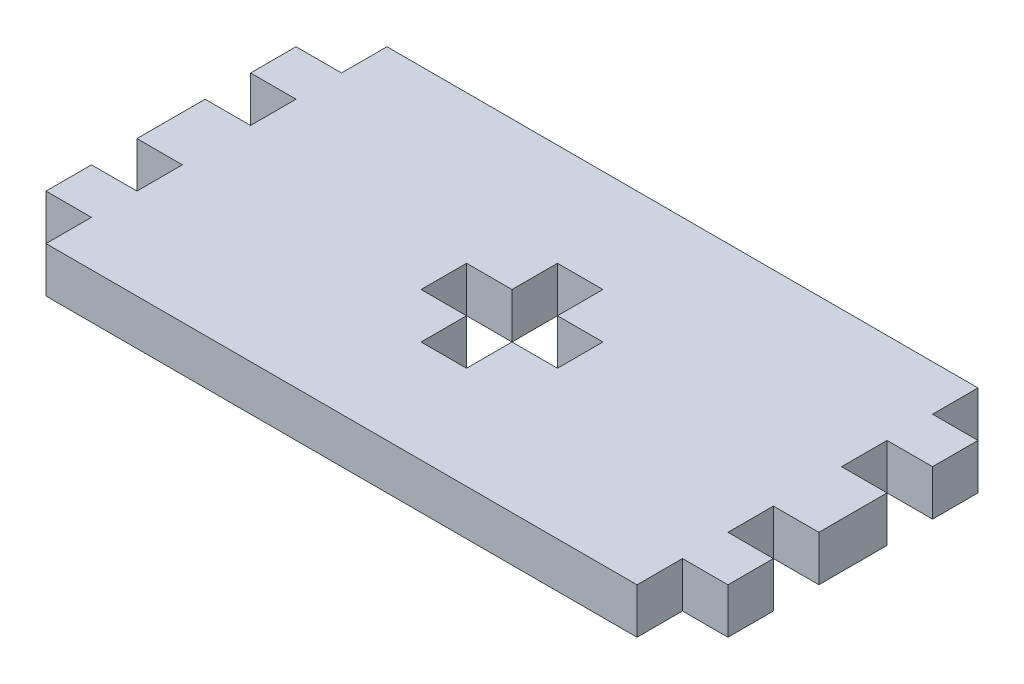
from build123d import *

# Parameters (mm, degrees)
SKETCH1_W           = 76.2
SKETCH1_H           = 38.1
BOSS_EXTRUDE1_DEPTH = 5.08
SKETCH2_W           = 5.08
SKETCH2_H           = 5.08
CUT_EXTRUDE1_DEPTH  = 5.08


with BuildPart() as part:
    # Sketch1 → Boss-Extrude1 (new body)
    with BuildSketch(Plane(origin=(0, 0, 0), x_dir=(1, 0, 0), z_dir=(0, 1, 0))):
        with Locations((-0.653142857, 12.627428571)):
            Rectangle(SKETCH1_W, SKETCH1_H)
    extrude(amount=BOSS_EXTRUDE1_DEPTH)

    # Sketch2 → Cut-Extrude1 (cut)
    with BuildSketch(Plane(origin=(0, 5.08, 0), x_dir=(1, 0, 0), z_dir=(0, 1, 0))):
        Polygon((1.886857143, 20.247428571), (-3.193142857, 20.247428571), (-3.193142857, 15.167428571), (-8.273142857, 15.167428571), (-8.273142857, 10.087428571), (-3.193142857, 10.087428571), (-3.193142857, 5.007428571), (1.886857143, 5.007428571), (1.886857143, 10.087428571), (6.966857143, 10.087428571), (6.966857143, 15.167428571), (1.886857143, 15.167428571), align=None)
        with Locations((-36.213142857, 18.977428571)):
            Rectangle(SKETCH2_W, SKETCH2_H)
        with Locations((-36.213142857, 29.137428571)):
            Rectangle(SKETCH2_W, SKETCH2_H)
        with Locations((-36.213142857, -3.882571429)):
            Rectangle(SKETCH2_W, SKETCH2_H)
        with Locations((-36.213142857, 6.277428571)):
            Rectangle(SKETCH2_W, SKETCH2_H)
        with Locations((34.906857143, 6.277428571)):
            Rectangle(SKETCH2_W, SKETCH2_H)
        with Locations((34.906857143, -3.882571429)):
            Rectangle(SKETCH2_W, SKETCH2_H)
        with Locations((34.906857143, 29.137428571)):
            Rectangle(SKETCH2_W, SKETCH2_H)
        with Locations((34.906857143, 18.977428571)):
            Rectangle(SKETCH2_W, SKETCH2_H)
    extrude(amount=-CUT_EXTRUDE1_DEPTH, mode=Mode.SUBTRACT)


solid = part.part
